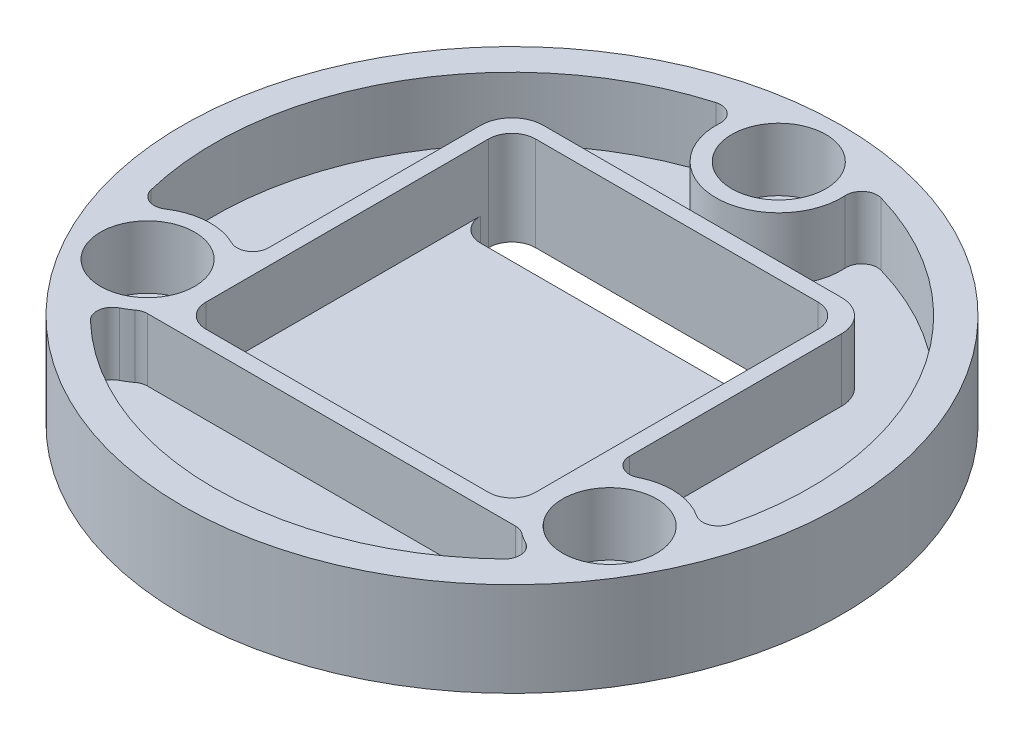
from build123d import *

# Parameters (mm, degrees)
SKETCH1_R           = 21
BOSS_EXTRUDE1_DEPTH = 2
SKETCH2_R           = 21
SKETCH2_R_2         = 3
BOSS_EXTRUDE2_DEPTH = 4
CUT_EXTRUDE1_START  = -2
SKETCH3_R           = 2
CUT_EXTRUDE1_DEPTH  = 2


with BuildPart() as part:
    # Sketch1 → Boss-Extrude1 (new body)
    with BuildSketch(Plane(origin=(0, 0, 0), x_dir=(1, 0, 0), z_dir=(0, 1, 0))):
        with Locations(Location((0, 0, 0), (0, 0, 270))):
            Circle(SKETCH1_R)
    extrude(amount=BOSS_EXTRUDE1_DEPTH)

    # Sketch2 → Boss-Extrude2 (add)
    with BuildSketch(Plane(origin=(0, 2, 0), x_dir=(1, 0, 0), z_dir=(0, 1, 0))):
        with Locations(Location((0, 0, 0), (0, 0, 270))):
            Circle(SKETCH2_R)
        with Locations(Location((0, 17, 0), (0, 0, 270))):
            Circle(SKETCH2_R_2, mode=Mode.SUBTRACT)
        with Locations(Location((14.722431864, -8.5, 0), (0, 0, 270))):
            Circle(SKETCH2_R_2, mode=Mode.SUBTRACT)
        with Locations(Location((-14.722431864, -8.5, 0), (0, 0, 270))):
            Circle(SKETCH2_R_2, mode=Mode.SUBTRACT)
        with BuildLine():
            Line((-11.5, -4.021071935), (-11.5, 9.5))
            ThreePointArc((-11.5, 9.5), (-10.914213562, 10.914213562), (-9.5, 11.5))
            Line((-9.5, 11.5), (9.5, 11.5))
            ThreePointArc((9.5, 11.5), (10.914213562, 10.914213562), (11.5, 9.5))
            Line((11.5, 9.5), (11.5, -4.021071935))
            ThreePointArc((11.5, -4.021071935), (11.972973612, -4.870920855), (12.944486373, -4.916857548))
            ThreePointArc((12.944486373, -4.916857548), (14.965992077, -4.507422083), (16.922739342, -5.159543893))
            ThreePointArc((16.922739342, -5.159543893), (17.83709693, -5.255719057), (18.443528223, -4.564675969))
            ThreePointArc((18.443528223, -4.564675969), (16.454482672, 9.5), (5.268638762, 18.254901961))
            ThreePointArc((5.268638762, 18.254901961), (4.366962246, 18.075238599), (3.993073588, 17.235294118))
            ThreePointArc((3.993073588, 17.235294118), (2.9104275, 14.256022638), (0, 13))
            ThreePointArc((0, 13), (-2.9104275, 14.256022638), (-3.993073588, 17.235294118))
            ThreePointArc((-3.993073588, 17.235294118), (-4.366962246, 18.075238599), (-5.268638762, 18.254901961))
            ThreePointArc((-5.268638762, 18.254901961), (-16.454482672, 9.5), (-18.443528223, -4.564675969))
            ThreePointArc((-18.443528223, -4.564675969), (-17.83709693, -5.255719057), (-16.922739342, -5.159543893))
            ThreePointArc((-16.922739342, -5.159543893), (-14.965992077, -4.507422083), (-12.944486373, -4.916857548))
            ThreePointArc((-12.944486373, -4.916857548), (-11.972973612, -4.870920855), (-11.5, -4.021071935))
        make_face(mode=Mode.SUBTRACT)
        with BuildLine():
            Line((9, -10.5), (-9, -10.5))
            ThreePointArc((-9, -10.5), (-10.060660172, -10.060660172), (-10.5, -9))
            Line((-10.5, -9), (-10.5, 9))
            ThreePointArc((-10.5, 9), (-10.060660172, 10.060660172), (-9, 10.5))
            Line((-9, 10.5), (9, 10.5))
            ThreePointArc((9, 10.5), (10.060660172, 10.060660172), (10.5, 9))
            Line((10.5, 9), (10.5, -9))
            ThreePointArc((10.5, -9), (10.060660172, -10.060660172), (9, -10.5))
        make_face(mode=Mode.SUBTRACT)
        with BuildLine():
            Line((11.5, -11.5), (-11.5, -11.5))
            Line((-11.5, -11.5), (-11.722431864, -11.5))
            ThreePointArc((-11.722431864, -11.5), (-12.03865963, -11.551316702), (-12.322431864, -11.7))
            ThreePointArc((-12.322431864, -11.7), (-12.617647084, -11.901452782), (-12.929665754, -12.075750225))
            ThreePointArc((-12.929665754, -12.075750225), (-13.470134683, -12.819519543), (-13.174889461, -13.690225991))
            ThreePointArc((-13.174889461, -13.690225991), (0, -19), (13.174889461, -13.690225991))
            ThreePointArc((13.174889461, -13.690225991), (13.470134683, -12.819519543), (12.929665754, -12.075750225))
            ThreePointArc((12.929665754, -12.075750225), (12.617647084, -11.901452782), (12.322431864, -11.7))
            ThreePointArc((12.322431864, -11.7), (12.03865963, -11.551316702), (11.722431864, -11.5))
            Line((11.722431864, -11.5), (11.5, -11.5))
        make_face(mode=Mode.SUBTRACT)
    extrude(amount=BOSS_EXTRUDE2_DEPTH)

    # Sketch3 → Cut-Extrude1 (cut)
    with BuildSketch(Plane(origin=(0, 2, 0), x_dir=(1, 0, 0), z_dir=(0, 1, 0)).offset(CUT_EXTRUDE1_START)):
        with Locations(Location((0, 17, 0), (0, 0, 270))):
            Circle(SKETCH3_R)
        with Locations(Location((14.722431864, -8.5, 0), (0, 0, 270))):
            Circle(SKETCH3_R)
        with Locations(Location((-14.722431864, -8.5, 0), (0, 0, 270))):
            Circle(SKETCH3_R)
        with BuildLine():
            Line((9, 7), (-9, 7))
            ThreePointArc((-9, 7), (-10.060660172, 7.439339828), (-10.5, 8.5))
            Line((-10.5, 8.5), (-10.5, 9))
            ThreePointArc((-10.5, 9), (-10.060660172, 10.060660172), (-9, 10.5))
            Line((-9, 10.5), (9, 10.5))
            ThreePointArc((9, 10.5), (10.060660172, 10.060660172), (10.5, 9))
            Line((10.5, 9), (10.5, 8.5))
            ThreePointArc((10.5, 8.5), (10.060660172, 7.439339828), (9, 7))
        make_face()
    extrude(amount=CUT_EXTRUDE1_DEPTH, mode=Mode.SUBTRACT)


solid = part.part
